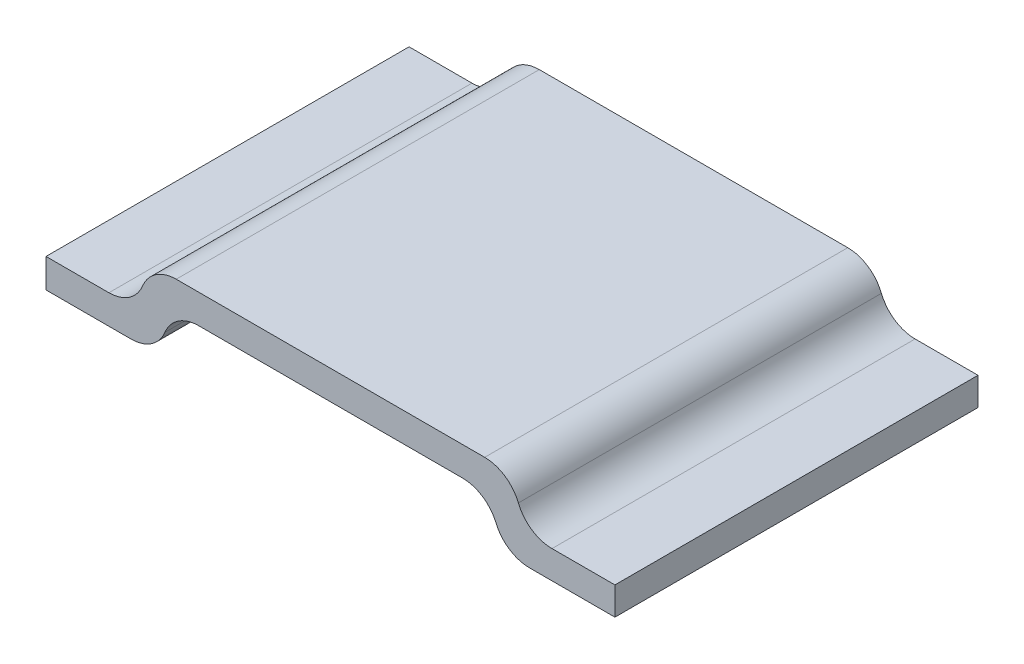
from build123d import *

# Parameters (mm, degrees)
BOSS_EXTRUDE1_DEPTH = 25.4
FILLET1_R           = 2.54
FILLET2_R           = 2.54
FILLET3_R           = 2.54
FILLET5_R           = 2.54
FILLET6_R           = 2.54


with BuildPart() as part:
    # Sketch1 → Boss-Extrude1 (new body)
    with BuildSketch(Plane.XY):
        Polygon((-12.7, 0), (12.7, 0), (13.550738686, -3.175), (19.900738686, -3.175), (19.900738686, -5.131589334), (11.971324019, -5.131589334), (11.14079156, -2.032), (-11.14079156, -2.032), (-11.991530246, -5.207), (-19.900738686, -5.207), (-19.900738686, -3.175), (-13.550738686, -3.175), align=None)
    extrude(amount=BOSS_EXTRUDE1_DEPTH)

    # Fillet1
    fillet1_edges = [part.edges().sort_by_distance(p)[0] for p in [
        (13.550738686, -3.175, 12.7),
    ]]
    fillet(fillet1_edges, radius=FILLET1_R)

    # Fillet2
    fillet2_edges = [part.edges().sort_by_distance(p)[0] for p in [
        (12.7, 0, 12.7),
    ]]
    fillet(fillet2_edges, radius=FILLET2_R)

    # Fillet3
    fillet3_edges = [part.edges().sort_by_distance(p)[0] for p in [
        (-11.991530246, -5.207, 12.7),
        (11.971324019, -5.131589334, 12.7),
    ]]
    fillet(fillet3_edges, radius=FILLET3_R)

    # Fillet5
    fillet5_edges = [part.edges().sort_by_distance(p)[0] for p in [
        (-13.550738686, -3.175, 12.7),
        (11.14079156, -2.032, 12.7),
        (-11.14079156, -2.032, 12.7),
    ]]
    fillet(fillet5_edges, radius=FILLET5_R)

    # Fillet6
    fillet6_edges = [part.edges().sort_by_distance(p)[0] for p in [
        (-12.7, 0, 12.7),
    ]]
    fillet(fillet6_edges, radius=FILLET6_R)


solid = part.part
